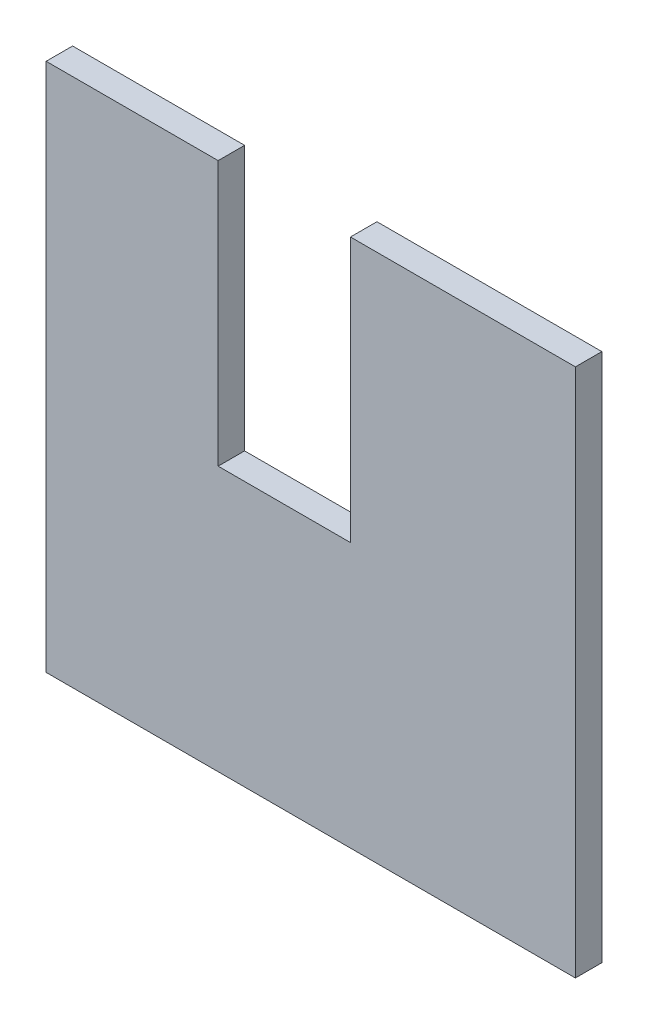
from build123d import *

# Parameters (mm, degrees)
BOSS_EXTRUDE1_DEPTH = 10


with BuildPart() as part:
    # Sketch2 → Boss-Extrude1 (new body)
    with BuildSketch(Plane.XY):
        Polygon((-90, 100), (-90, -100), (110, -100), (110, 100), (25, 100), (25, 0), (-25, 0), (-25, 100), align=None)
    extrude(amount=BOSS_EXTRUDE1_DEPTH)


solid = part.part
